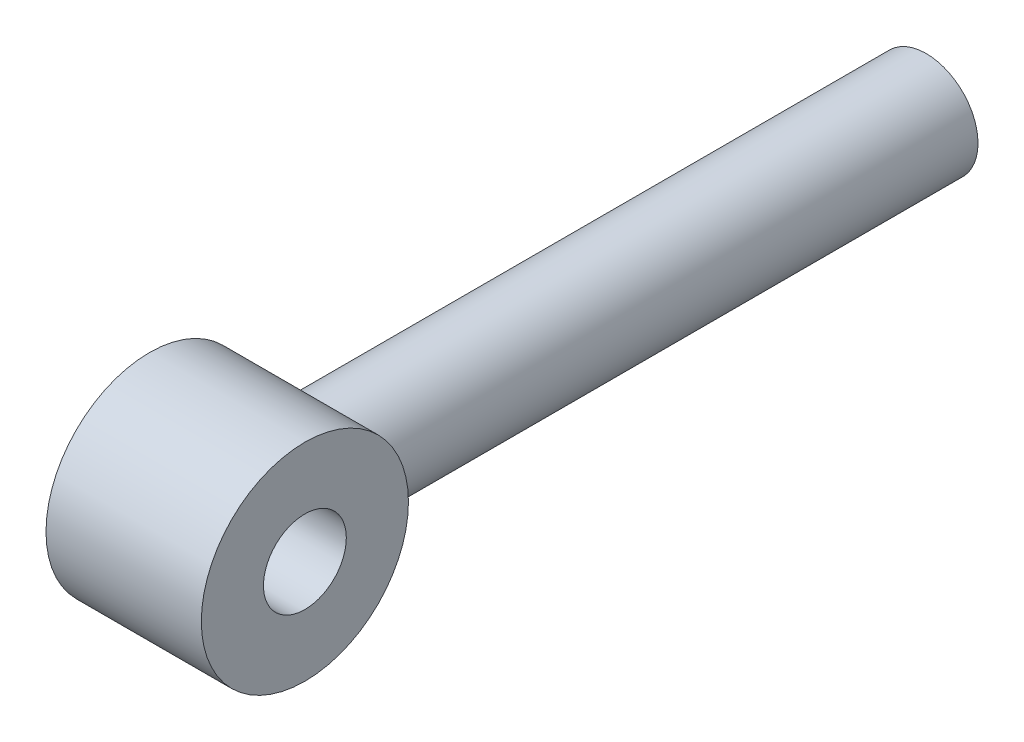
from build123d import *

# Parameters (mm, degrees)
SHAFT_SECTION_W    = 2
SHAFT_SECTION_H    = 24
EYE_SKETCH_R       = 4
EYE_EXTRUDE_DEPTH  = 3
EYE_BORE_SKETCH_R  = 1.6
EYE_BORE_CUT_DEPTH = 3


with BuildPart() as part:
    # Shaft Section → Rod Revolve (revolve)
    with BuildSketch(Plane(origin=(0, 0, 0), x_dir=(1, 0, 0), z_dir=(0, 1, 0))):
        with Locations((1, 15)):
            Rectangle(SHAFT_SECTION_W, SHAFT_SECTION_H)
    revolve(axis=Axis((0, 0, 10.123), (0, 0, -1)))

    # Eye Sketch → Eye Extrude (add, symmetric)
    with BuildSketch(Plane(origin=(0, 0, 0), x_dir=(0, 0, -1), z_dir=(1, 0, 0))):
        Circle(EYE_SKETCH_R)
    extrude(amount=EYE_EXTRUDE_DEPTH, both=True)

    # Eye Bore Sketch → Eye Bore Cut (cut, symmetric)
    with BuildSketch(Plane(origin=(0, 0, 0), x_dir=(0, 0, -1), z_dir=(1, 0, 0))):
        Circle(EYE_BORE_SKETCH_R)
    extrude(amount=EYE_BORE_CUT_DEPTH, both=True, mode=Mode.SUBTRACT)


solid = part.part
